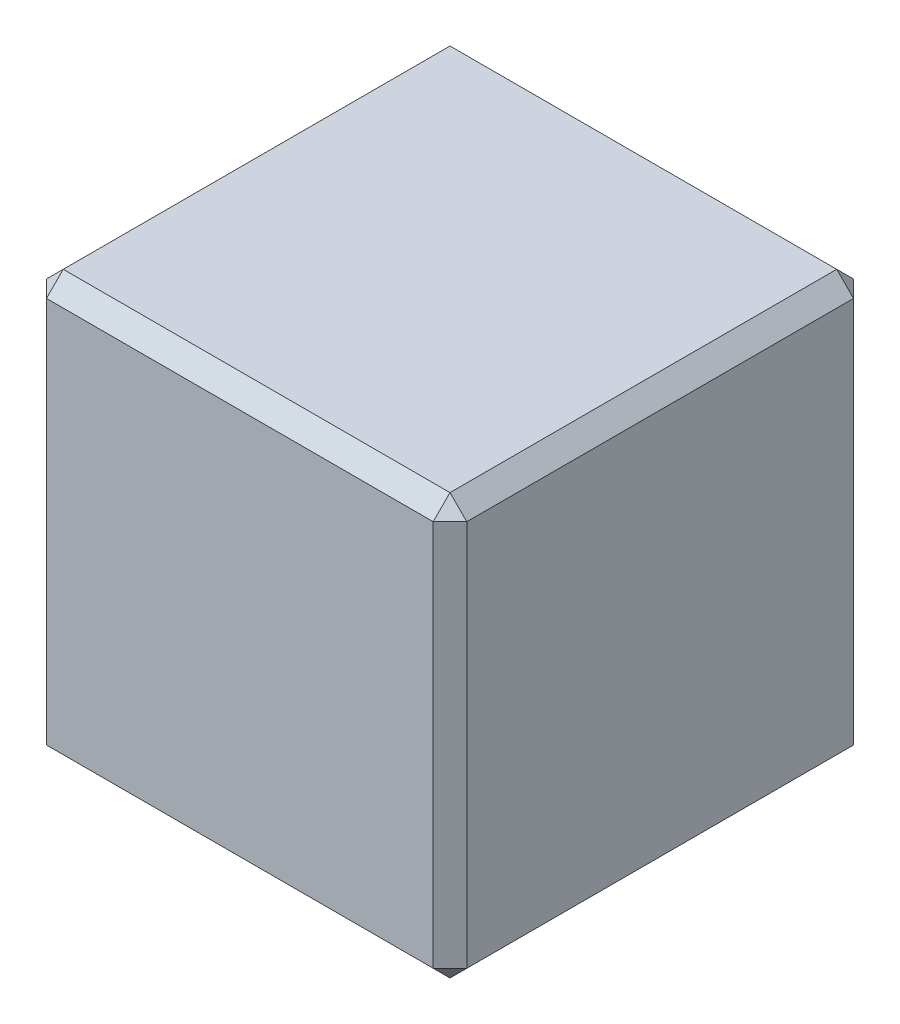
from build123d import *

# Parameters (mm, degrees)
ESQUISSE1_W        = 50
ESQUISSE1_H        = 50
BOSS_EXTRU_1_DEPTH = 50
CHANFREIN1_SIZE    = 2


with BuildPart() as part:
    # Esquisse1 → Boss.-Extru.1 (new body)
    with BuildSketch(Plane.XY):
        with Locations((25, 25)):
            Rectangle(ESQUISSE1_W, ESQUISSE1_H)
    extrude(amount=BOSS_EXTRU_1_DEPTH)

    # Chanfrein1
    chanfrein1_edges = [part.edges().sort_by_distance(p)[0] for p in [
        (50, 25, 50),
        (25, 50, 50),
        (0, 25, 50),
        (25, 50, 0),
        (50, 25, 0),
        (25, 0, 0),
        (0, 25, 0),
        (0, 50, 25),
        (50, 50, 25),
        (50, 0, 25),
        (0, 0, 25),
        (25, 0, 50),
    ]]
    chamfer(chanfrein1_edges, length=CHANFREIN1_SIZE)


solid = part.part
